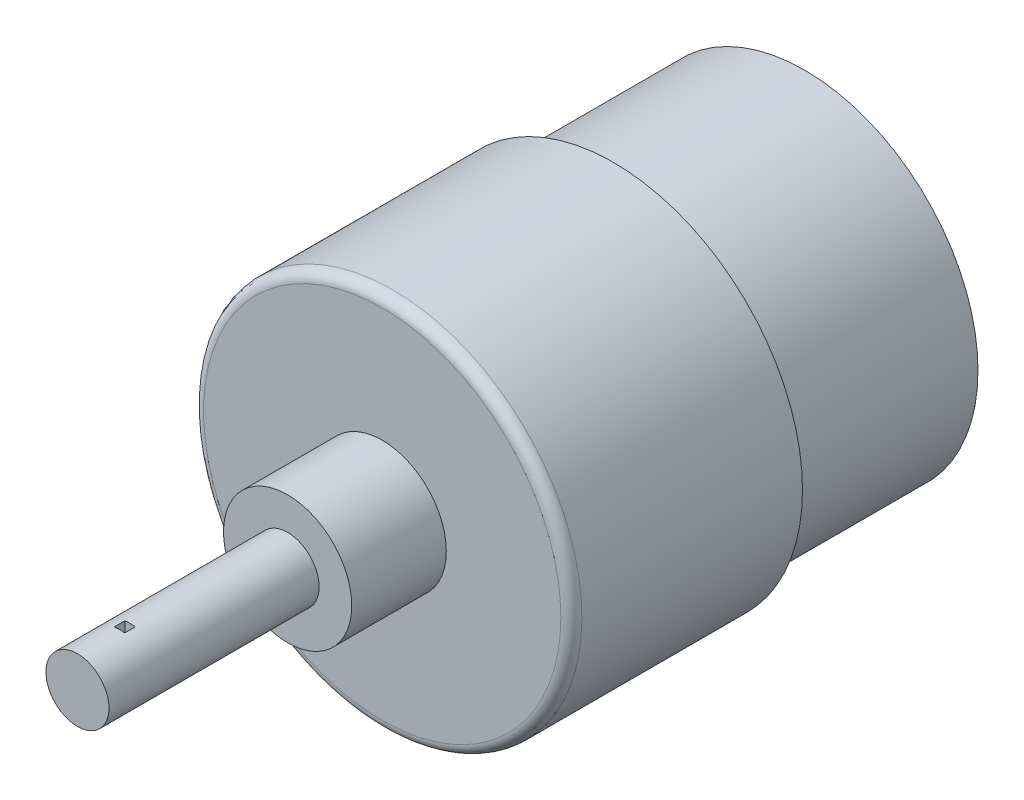
from build123d import *

# Parameters (mm, degrees)
SKETCH1_R           = 18
BOSS_EXTRUDE1_DEPTH = 22
SKETCH2_R           = 6.1
BOSS_EXTRUDE2_DEPTH = 9
SKETCH3_R           = 3
BOSS_EXTRUDE3_DEPTH = 20
SKETCH4_R           = 16.5
BOSS_EXTRUDE4_DEPTH = 18.2
FILLET1_R           = 1
CUT_EXTRUDE1_START  = -4
SKETCH5_W           = 1
SKETCH5_H           = 9.640702938
CUT_EXTRUDE1_DEPTH  = 1


with BuildPart() as part:
    # Sketch1 → Boss-Extrude1 (new body)
    with BuildSketch(Plane.XY):
        Circle(SKETCH1_R)
    extrude(amount=BOSS_EXTRUDE1_DEPTH)

    # Sketch2 → Boss-Extrude2 (add)
    with BuildSketch(Plane.XY.offset(22)):
        Circle(SKETCH2_R)
    extrude(amount=BOSS_EXTRUDE2_DEPTH)

    # Sketch3 → Boss-Extrude3 (add)
    with BuildSketch(Plane.XY.offset(31)):
        Circle(SKETCH3_R)
    extrude(amount=BOSS_EXTRUDE3_DEPTH)

    # Sketch4 → Boss-Extrude4 (add)
    with BuildSketch(Plane(origin=(0, 0, 0), x_dir=(-1, 0, 0), z_dir=(0, 0, -1))):
        with Locations(Location((0, 0, 0), (0, 0, 180))):
            Circle(SKETCH4_R)
    extrude(amount=BOSS_EXTRUDE4_DEPTH)

    # Fillet1
    fillet1_edges = [part.edges().sort_by_distance(p)[0] for p in [
        (-18, 0, 22),
    ]]
    fillet(fillet1_edges, radius=FILLET1_R)

    # Sketch5 → Cut-Extrude1 (cut)
    with BuildSketch(Plane.XY.offset(51).offset(CUT_EXTRUDE1_START)):
        Rectangle(SKETCH5_W, SKETCH5_H)
    extrude(amount=-CUT_EXTRUDE1_DEPTH, mode=Mode.SUBTRACT)


solid = part.part
